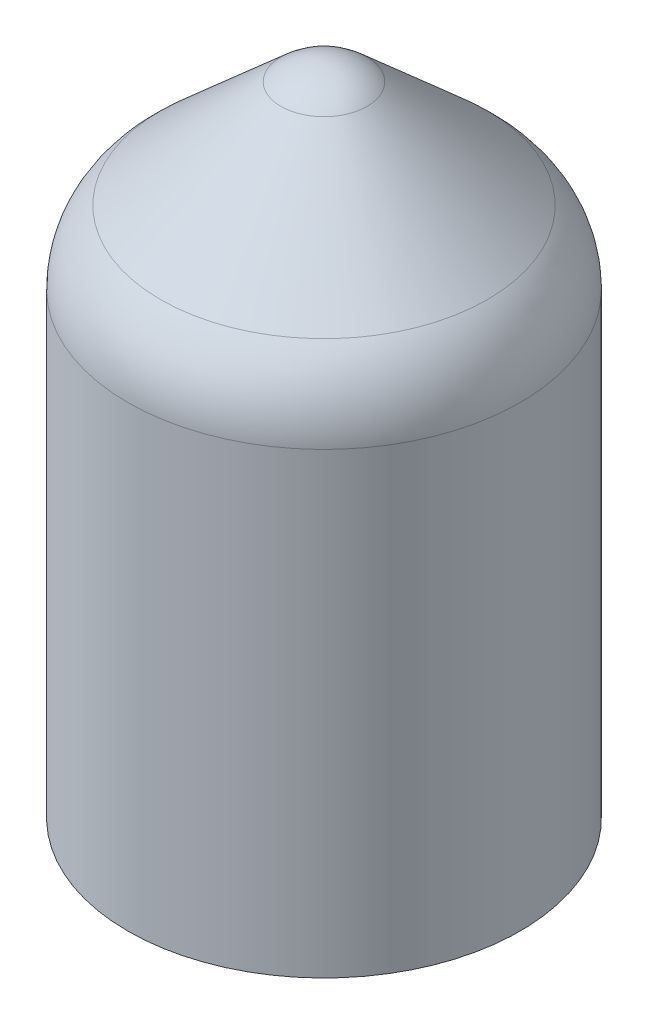
from build123d import *

# Parameters (mm, degrees)
SHELL2_T = -2


with BuildPart() as part:
    # Sketch1 → Revolve2 (revolve)
    with BuildSketch(Plane.XY, mode=Mode.PRIVATE) as revolve2_sk:
        with BuildLine():
            Line((50, 162.262364882), (13.155033794, 195))
            ThreePointArc((13.155033794, 195), (7.036599216, 198.707848685), (0, 200))
            Line((0, 200), (0, 140))
            Line((0, 140), (0, 0))
            Line((0, 0), (60, 0))
            Line((60, 0), (60, 140))
            ThreePointArc((60, 140), (57.38520841, 152.202590812), (50, 162.262364882))
        make_face()
    revolve(revolve2_sk.sketch.rotate(Axis((0, 0, 0), (0, 1, 0)), 90), axis=Axis((0, 0, 0), (0, 1, 0)))

    # Shell2
    shell2_openings = [part.faces().sort_by_distance(p)[0] for p in [
        (0, 0, 0),
    ]]
    offset(amount=SHELL2_T, openings=shell2_openings, kind=Kind.INTERSECTION)


solid = part.part
